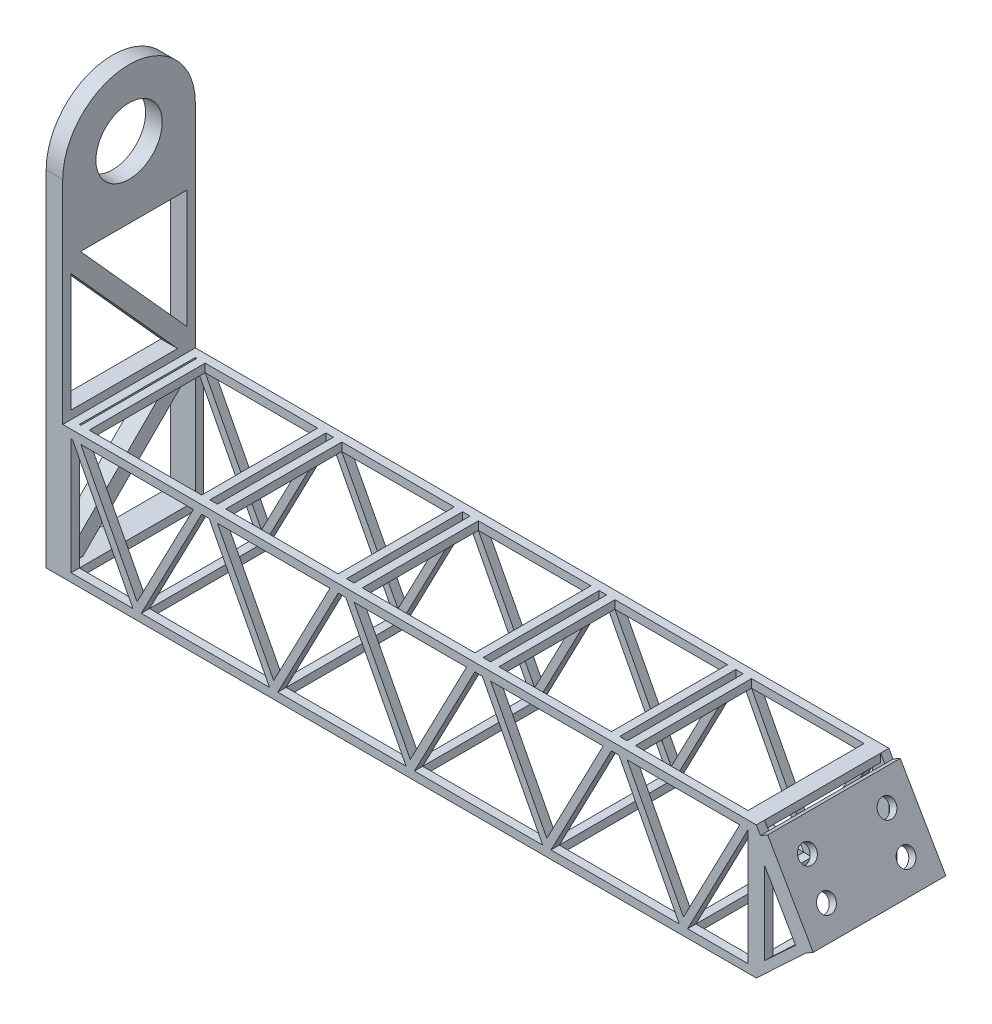
from build123d import *

# Parameters (mm, degrees)
BOSS_EXTRUDE1_DEPTH      = 1.5875
SKETCH2_W                = 1.5875
SKETCH2_H                = 1.5875
BOSS_EXTRUDE2_DEPTH      = 132.842
SKETCH3_W                = 25.4
SKETCH3_H                = 25.4
SKETCH3_W_2              = 22.225
SKETCH3_H_2              = 22.225
BOSS_EXTRUDE3_DEPTH      = 1.5875
BOSS_EXTRUDE4_START      = -1.5875
BOSS_EXTRUDE4_DEPTH      = 22.225
BOSS_EXTRUDE5_DEPTH      = 1.5875
LPATTERN1_COUNT          = 5
LPATTERN1_PITCH          = 26.162
MIRROR6_COPY_1_DEPTH     = 1.5875
MIRROR6_COPY_2_DEPTH     = 1.5875
MIRROR6_COPY_3_DEPTH     = 1.5875
MIRROR6_COPY_4_DEPTH     = 1.5875
BOSS_EXTRUDE6_START      = -1.5875
SKETCH10_W               = 1.5875
SKETCH10_H               = 1.5875
BOSS_EXTRUDE6_DEPTH      = 22.225
LPATTERN2_COUNT          = 5
LPATTERN2_PITCH          = 26.162
SKETCH12_W               = 25.4
SKETCH12_H               = 17.4625
BOSS_EXTRUDE13_DEPTH     = 1.5875
M3_CLEARANCE_HOLE1_D     = 3.4
M3_CLEARANCE_HOLE1_DEPTH = 1.5875
SKETCH19_W               = 3.175
SKETCH19_H               = 25.4
BOSS_EXTRUDE14_DEPTH     = 66.04
BOSS_EXTRUDE15_DEPTH     = 3.175
SKETCH21_R               = 6.35
CUT_EXTRUDE1_DEPTH       = 3.175


with BuildPart() as part:
    # Sketch1 → Boss-Extrude1 (new body)
    with BuildSketch(Plane.XY):
        Polygon((0, 0), (0, 25.4), (9.525, 8.902216058), align=None)
        Polygon((7.519534439, 9.200784302), (1.5875, 3.656610839), (1.5875, 19.475369343), align=None, mode=Mode.SUBTRACT)
    extrude(amount=BOSS_EXTRUDE1_DEPTH)

    # Sketch2 → Boss-Extrude2 (add)
    with BuildSketch(Plane.ZY):
        with Locations((0.79375, 24.60625)):
            Rectangle(SKETCH2_W, SKETCH2_H)
        with Locations((0.79375, 0.79375)):
            Rectangle(SKETCH2_W, SKETCH2_H)
    extrude(amount=BOSS_EXTRUDE2_DEPTH)

    # Sketch3 → Boss-Extrude3 (add)
    with BuildSketch(Plane.ZY.offset(132.842)):
        with Locations((12.7, 12.7)):
            Rectangle(SKETCH3_W, SKETCH3_H)
        with Locations((12.7, 12.7)):
            Rectangle(SKETCH3_W_2, SKETCH3_H_2, mode=Mode.SUBTRACT)
    boss_extrude3 = extrude(amount=-BOSS_EXTRUDE3_DEPTH)

    # Mirror4: part across plane


with BuildPart() as part_1:
    add(part.part)
    add(part.part.mirror(Plane.XY.offset(12.7)))

    # Mirror5: Boss-Extrude3 across plane
    add(boss_extrude3.mirror(Plane(origin=(-66.421, 0, 0), x_dir=(0, 0, 1), z_dir=(1, 0, 0))))

    # Sketch7 → Boss-Extrude4 (add)
    with BuildSketch(Plane(origin=(0, 0, 0), x_dir=(-1, 0, 0), z_dir=(0, 0, -1)).offset(BOSS_EXTRUDE4_START)):
        Polygon((-9.525, 8.902216058), (-8.334375, 7.789439051), (-7.519534439, 9.200784302), (-8.710159439, 10.313561309), align=None)
    extrude(amount=-BOSS_EXTRUDE4_DEPTH)

    # Sketch9 → Boss-Extrude5 (add)
    with BuildSketch(Plane(origin=(0, 0, 0), x_dir=(-1, 0, 0), z_dir=(0, 0, -1))):
        Polygon((1.5875, 23.8125), (13.157102699, 1.5875), (14.744602699, 1.5875), (26.314205397, 23.8125), (24.726705397, 23.8125), (13.950852699, 3.112279563), (3.175, 23.8125), align=None)
    boss_extrude5 = extrude(amount=-BOSS_EXTRUDE5_DEPTH)

    # LPattern1: Boss-Extrude5 ×5
    with Locations(*[(-i * LPATTERN1_PITCH, 0, 0) for i in range(1, LPATTERN1_COUNT)]):
        add(boss_extrude5)

    # Mirror6: Boss-Extrude5 across plane
    add(boss_extrude5.mirror(Plane.XY.offset(12.7)))

    # Mirror6 copy 1 sketch → Mirror6 copy 1 (add)
    with BuildSketch(Plane(origin=(-26.162, 0, 25.4), x_dir=(-1, 0, 0), z_dir=(0, 0, 1))):
        Polygon((1.5875, -23.8125), (13.157102699, -1.5875), (14.744602699, -1.5875), (26.314205397, -23.8125), (24.726705397, -23.8125), (13.950852699, -3.112279563), (3.175, -23.8125), align=None)
    extrude(amount=-MIRROR6_COPY_1_DEPTH)

    # Mirror6 copy 2 sketch → Mirror6 copy 2 (add)
    with BuildSketch(Plane(origin=(-52.324, 0, 25.4), x_dir=(-1, 0, 0), z_dir=(0, 0, 1))):
        Polygon((1.5875, -23.8125), (13.157102699, -1.5875), (14.744602699, -1.5875), (26.314205397, -23.8125), (24.726705397, -23.8125), (13.950852699, -3.112279563), (3.175, -23.8125), align=None)
    extrude(amount=-MIRROR6_COPY_2_DEPTH)

    # Mirror6 copy 3 sketch → Mirror6 copy 3 (add)
    with BuildSketch(Plane(origin=(-78.486, 0, 25.4), x_dir=(-1, 0, 0), z_dir=(0, 0, 1))):
        Polygon((1.5875, -23.8125), (13.157102699, -1.5875), (14.744602699, -1.5875), (26.314205397, -23.8125), (24.726705397, -23.8125), (13.950852699, -3.112279563), (3.175, -23.8125), align=None)
    extrude(amount=-MIRROR6_COPY_3_DEPTH)

    # Mirror6 copy 4 sketch → Mirror6 copy 4 (add)
    with BuildSketch(Plane(origin=(-104.648, 0, 25.4), x_dir=(-1, 0, 0), z_dir=(0, 0, 1))):
        Polygon((1.5875, -23.8125), (13.157102699, -1.5875), (14.744602699, -1.5875), (26.314205397, -23.8125), (24.726705397, -23.8125), (13.950852699, -3.112279563), (3.175, -23.8125), align=None)
    extrude(amount=-MIRROR6_COPY_4_DEPTH)

    # Sketch10 → Boss-Extrude6 (add)
    with BuildSketch(Plane(origin=(0, 0, 0), x_dir=(-1, 0, 0), z_dir=(0, 0, -1)).offset(BOSS_EXTRUDE6_START)):
        with Locations((118.598852699, 0.79375)):
            Rectangle(SKETCH10_W, SKETCH10_H)
        with Locations((130.168455397, 24.60625)):
            Rectangle(SKETCH10_W, SKETCH10_H)
        with Locations((107.02925, 24.60625)):
            Rectangle(SKETCH10_W, SKETCH10_H)
    boss_extrude6 = extrude(amount=-BOSS_EXTRUDE6_DEPTH)

    # LPattern2: Boss-Extrude6 ×5
    with Locations(*[(i * LPATTERN2_PITCH, 0, 0) for i in range(1, LPATTERN2_COUNT)]):
        add(boss_extrude6)

    # Sketch12 → Boss-Extrude13 (add)
    with BuildSketch(Plane(origin=(10.998522628, 6.35, 0), x_dir=(0, 0, -1), z_dir=(0.8660254037844415, 0.49999999999999506, 0))):
        with Locations((-12.7, 11.678295256)):
            Rectangle(SKETCH12_W, SKETCH12_H)
    extrude(amount=BOSS_EXTRUDE13_DEPTH)

    # M3 Clearance Hole1
    with Locations(Plane(origin=(12.373337957, 7.14375, 0), x_dir=(0, 0, -1), z_dir=(0.8660254037844414, 0.49999999999999517, 0))):
        with Locations((-20.32, 15.329545256), (-20.32, 8.027045256), (-5.08, 15.329545256), (-5.08, 8.027045256)):
            Hole(M3_CLEARANCE_HOLE1_D / 2, depth=M3_CLEARANCE_HOLE1_DEPTH)

    # Sketch19 → Boss-Extrude14 (add)
    with BuildSketch(Plane(origin=(0, 0, 0), x_dir=(1, 0, 0), z_dir=(0, 1, 0))):
        with Locations((-134.4295, -12.7)):
            Rectangle(SKETCH19_W, SKETCH19_H)
    extrude(amount=BOSS_EXTRUDE14_DEPTH)

    # Sketch20 → Boss-Extrude15 (add)
    with BuildSketch(Plane.ZY.offset(136.017)):
        with BuildLine():
            Line((0, 66.04), (25.4, 66.04))
            ThreePointArc((25.4, 66.04), (12.7, 78.74), (0, 66.04))
        make_face()
    extrude(amount=-BOSS_EXTRUDE15_DEPTH)

    # Sketch21 → Cut-Extrude1 (cut)
    with BuildSketch(Plane.ZY.offset(136.017)):
        with Locations((12.7, 66.04)):
            Circle(SKETCH21_R)
        Polygon((1.5875, 29.718299952), (21.998939404, 52.3875), (1.5875, 52.3875), align=None)
        Polygon((1.5875, 1.5875), (21.56743597, 1.5875), (1.5875, 21.56743597), align=None)
        Polygon((3.83256403, 23.8125), (23.8125, 23.8125), (23.8125, 3.83256403), align=None)
        Polygon((3.401060596, 26.9875), (23.8125, 26.9875), (23.8125, 49.656700048), align=None)
    extrude(amount=-CUT_EXTRUDE1_DEPTH, mode=Mode.SUBTRACT)


solid = part_1.part
